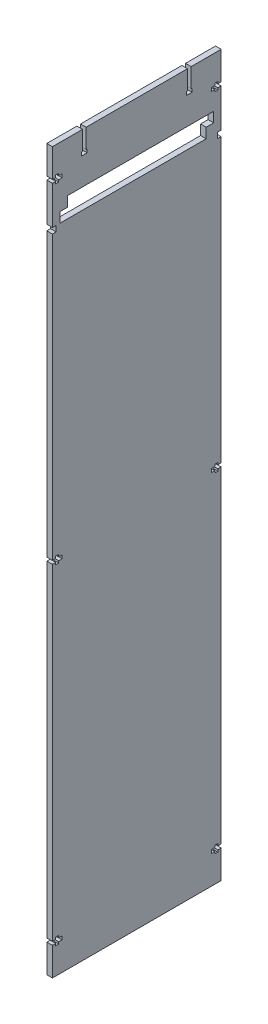
from build123d import *

# Parameters (mm, degrees)
SKETCH1_W           = 4.7625
SKETCH1_H           = 142.875
BOSS_EXTRUDE1_DEPTH = 609.6
SKETCH12_W          = 123.825
SKETCH12_H          = 8.509
CUT_EXTRUDE7_DEPTH  = 627.13745059
SKETCH13_W          = 123.825
SKETCH13_H          = 8.509
CUT_EXTRUDE8_DEPTH  = 627.13745059
SKETCH15_W          = 3.175
SKETCH15_H          = 4.7625
CUT_EXTRUDE10_DEPTH = 627.13745059
CUT_EXTRUDE11_DEPTH = 627.13745059
CUT_EXTRUDE12_DEPTH = 627.13745059


with BuildPart() as part:
    # Sketch1 → Boss-Extrude1 (new body)
    with BuildSketch(Plane(origin=(0, 0, 0), x_dir=(1, 0, 0), z_dir=(0, 1, 0))):
        with Locations((2.38125, 71.4375)):
            Rectangle(SKETCH1_W, SKETCH1_H)
    extrude(amount=BOSS_EXTRUDE1_DEPTH)

    # Sketch12 → Cut-Extrude7 (cut, through all)
    with BuildSketch(Plane.ZY):
        with Locations((-68.2625, 554.5455)):
            Rectangle(SKETCH12_W, SKETCH12_H)
    extrude(amount=-CUT_EXTRUDE7_DEPTH, mode=Mode.SUBTRACT)

    # Sketch13 → Cut-Extrude8 (cut, through all)
    with BuildSketch(Plane.ZY):
        with Locations((-74.6125, 563.0545)):
            Rectangle(SKETCH13_W, SKETCH13_H)
    extrude(amount=-CUT_EXTRUDE8_DEPTH, mode=Mode.SUBTRACT)

    # Sketch15 → Cut-Extrude10 (cut, through all)
    with BuildSketch(Plane.ZY):
        with Locations((-1.5875, 547.90975)):
            Rectangle(SKETCH15_W, SKETCH15_H)
        with Locations((-141.2875, 547.90975)):
            Rectangle(SKETCH15_W, SKETCH15_H)
    extrude(amount=-CUT_EXTRUDE10_DEPTH, mode=Mode.SUBTRACT)

    # Sketch16 → Cut-Extrude11 (cut, through all)
    with BuildSketch(Plane.ZY):
        Polygon((-2.794, 23.9395), (-2.794, 22.1996), (-5.334, 22.1996), (-5.334, 23.9395), (-8.128, 23.9395), (-8.128, 26.8605), (-5.334, 26.8605), (-5.334, 28.6004), (-2.794, 28.6004), (-2.794, 26.8605), (0, 26.8605), (0, 23.9395), align=None)
        Polygon((-134.747, 26.8605), (-137.541, 26.8605), (-137.541, 28.6004), (-140.081, 28.6004), (-140.081, 26.8605), (-142.875, 26.8605), (-142.875, 23.9395), (-140.081, 23.9395), (-140.081, 22.1996), (-137.541, 22.1996), (-137.541, 23.9395), (-134.747, 23.9395), align=None)
        Polygon((-134.747, 306.2605), (-137.541, 306.2605), (-137.541, 308.0004), (-140.081, 308.0004), (-140.081, 306.2605), (-142.875, 306.2605), (-142.875, 303.3395), (-140.081, 303.3395), (-140.081, 301.5996), (-137.541, 301.5996), (-137.541, 303.3395), (-134.747, 303.3395), align=None)
        Polygon((-2.794, 303.3395), (-2.794, 301.5996), (-5.334, 301.5996), (-5.334, 303.3395), (-8.128, 303.3395), (-8.128, 306.2605), (-5.334, 306.2605), (-5.334, 308.0004), (-2.794, 308.0004), (-2.794, 306.2605), (0, 306.2605), (0, 303.3395), align=None)
        Polygon((-134.747, 585.6605), (-137.541, 585.6605), (-137.541, 587.4004), (-140.081, 587.4004), (-140.081, 585.6605), (-142.875, 585.6605), (-142.875, 582.7395), (-140.081, 582.7395), (-140.081, 580.9996), (-137.541, 580.9996), (-137.541, 582.7395), (-134.747, 582.7395), align=None)
        Polygon((-2.794, 582.7395), (-2.794, 580.9996), (-5.334, 580.9996), (-5.334, 582.7395), (-8.128, 582.7395), (-8.128, 585.6605), (-5.334, 585.6605), (-5.334, 587.4004), (-2.794, 587.4004), (-2.794, 585.6605), (0, 585.6605), (0, 582.7395), align=None)
    extrude(amount=-CUT_EXTRUDE11_DEPTH, mode=Mode.SUBTRACT)

    # Sketch17 → Cut-Extrude12 (cut, through all)
    with BuildSketch(Plane.ZY):
        Polygon((-28.5115, 593.337388892), (-29.3497, 593.337388892), (-29.3497, 590.416388892), (-24.6253, 590.416388892), (-24.6253, 593.337388892), (-25.4635, 593.337388892), (-25.4635, 609.6), (-28.5115, 609.6), align=None)
        Polygon((-117.4115, 609.6), (-114.3635, 609.6), (-114.3635, 593.337388892), (-113.5253, 593.337388892), (-113.5253, 590.416388892), (-118.2497, 590.416388892), (-118.2497, 593.337388892), (-117.4115, 593.337388892), align=None)
    extrude(amount=-CUT_EXTRUDE12_DEPTH, mode=Mode.SUBTRACT)


solid = part.part
